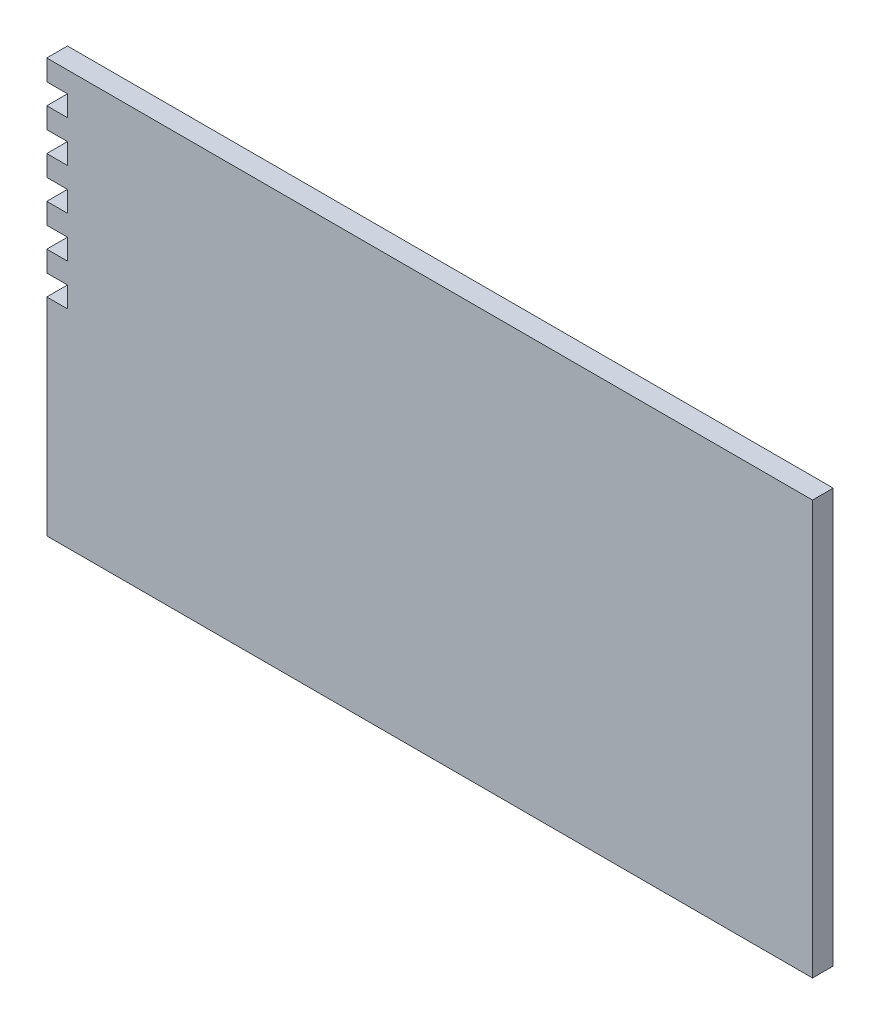
from build123d import *

# Parameters (mm, degrees)
ESBO_O1_W                = 222
ESBO_O1_H                = 120
RESSALTO_EXTRUS_O1_DEPTH = 6
ESBO_O3_W                = 6
ESBO_O3_H                = 6
CORTE_EXTRUS_O1_DEPTH    = 134.018795664
PADR_O_LINEAR2_COUNT     = 5
PADR_O_LINEAR2_PITCH     = 12


with BuildPart() as part:
    # Esboço1 → Ressalto-extrusão1 (new body)
    with BuildSketch(Plane.XY):
        with Locations((6, -3)):
            Rectangle(ESBO_O1_W, ESBO_O1_H)
    extrude(amount=RESSALTO_EXTRUS_O1_DEPTH)

    # Esboço3 → Corte-extrusão1 (cut, through all)
    with BuildSketch(Plane.XY.offset(6)):
        with Locations((-102, 0)):
            Rectangle(ESBO_O3_W, ESBO_O3_H)
    corte_extrus_o1 = extrude(amount=-CORTE_EXTRUS_O1_DEPTH, mode=Mode.SUBTRACT)

    # Padrão linear2: Corte-extrusão1 ×5
    with Locations(*[(0, i * PADR_O_LINEAR2_PITCH, 0) for i in range(1, PADR_O_LINEAR2_COUNT)]):
        add(corte_extrus_o1, mode=Mode.SUBTRACT)


solid = part.part
